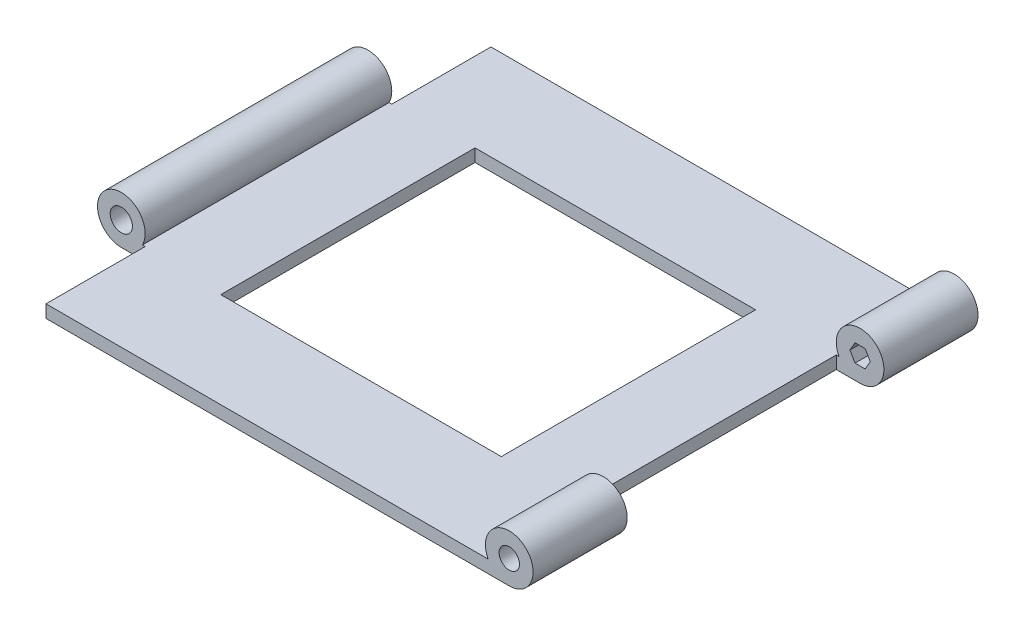
from build123d import *

# Parameters (mm, degrees)
SKETCH_1_R          = 3.5
EXTRUDE_1_DEPTH     = 140
SKETCH_2_W          = 31.2
SKETCH_2_H          = 17.479956732
CUT_EXTRUDE_1_DEPTH = 50
CUT_EXTRUDE_2_DEPTH = 60
SKETCH_4_R          = 3.2
CUT_EXTRUDE_3_DEPTH = 140.649970789
SKETCH_5_W          = 88.266499161
SKETCH_5_H          = 80
CUT_EXTRUDE_4_DEPTH = 165.458365818


with BuildPart() as part:
    # 草图1 → 凸台-拉伸1 (new body)
    with BuildSketch(Plane.XY):
        with BuildLine():
            Line((-77.479727509, -5.387494924), (75.786771652, -5.387494924))
            ThreePointArc((75.786771652, -5.387494924), (79.659754999, 8.535121366), (69.153522072, -1.387494924))
            Line((69.153522072, -1.387494924), (-70.846477928, -1.387494924))
            ThreePointArc((-70.846477928, -1.387494924), (-81.352710855, 8.535121366), (-77.479727509, -5.387494924))
        make_face()
        with Locations((-77.479727509, 2.112505076)):
            Circle(SKETCH_1_R, mode=Mode.SUBTRACT)
        Polygon((77.386771652, 4.883786368), (74.186771652, 4.883786368), (72.586771652, 2.112505076), (74.186771652, -0.658776216), (77.386771652, -0.658776216), (78.986771652, 2.112505076), align=None, mode=Mode.SUBTRACT)
    extrude(amount=-EXTRUDE_1_DEPTH)

    # 草图2 → 切除-拉伸1 (cut)
    with BuildSketch(Plane(origin=(-69.979727509, 0, 0), x_dir=(0, 0, -1), z_dir=(1, 0, 0))):
        with Locations((15.6, 0.87252671)):
            Rectangle(SKETCH_2_W, SKETCH_2_H)
        with Locations((124.4, 0.87252671)):
            Rectangle(SKETCH_2_W, SKETCH_2_H)
    extrude(amount=-CUT_EXTRUDE_1_DEPTH, mode=Mode.SUBTRACT)

    # 草图3 → 切除-拉伸2 (cut)
    with BuildSketch(Plane.ZY.offset(-68.286771652)):
        Polygon((-109.6, -19.072953763), (-30.4, -19.072953763), (-29.6, -19.072953763), (-29.6, 22.402056511), (-29.61, 22.402056511), (-110.39, 22.402056511), (-110.4, 22.402056511), (-110.4, -19.072953763), align=None)
    extrude(amount=-CUT_EXTRUDE_2_DEPTH, mode=Mode.SUBTRACT)

    # 草图4 → 切除-拉伸3 (cut, through all)
    with BuildSketch(Plane(origin=(0, 0, -29.6), x_dir=(-1, 0, 0), z_dir=(0, 0, -1))):
        with Locations((-75.786771652, 2.112505076)):
            Circle(SKETCH_4_R)
    extrude(amount=-CUT_EXTRUDE_3_DEPTH, mode=Mode.SUBTRACT)

    # 草图5 → 切除-拉伸4 (cut, through all)
    with BuildSketch(Plane.XZ.offset(5.387494924)):
        with Locations((-0.846477928, -70)):
            Rectangle(SKETCH_5_W, SKETCH_5_H)
    extrude(amount=-CUT_EXTRUDE_4_DEPTH, mode=Mode.SUBTRACT)


solid = part.part
